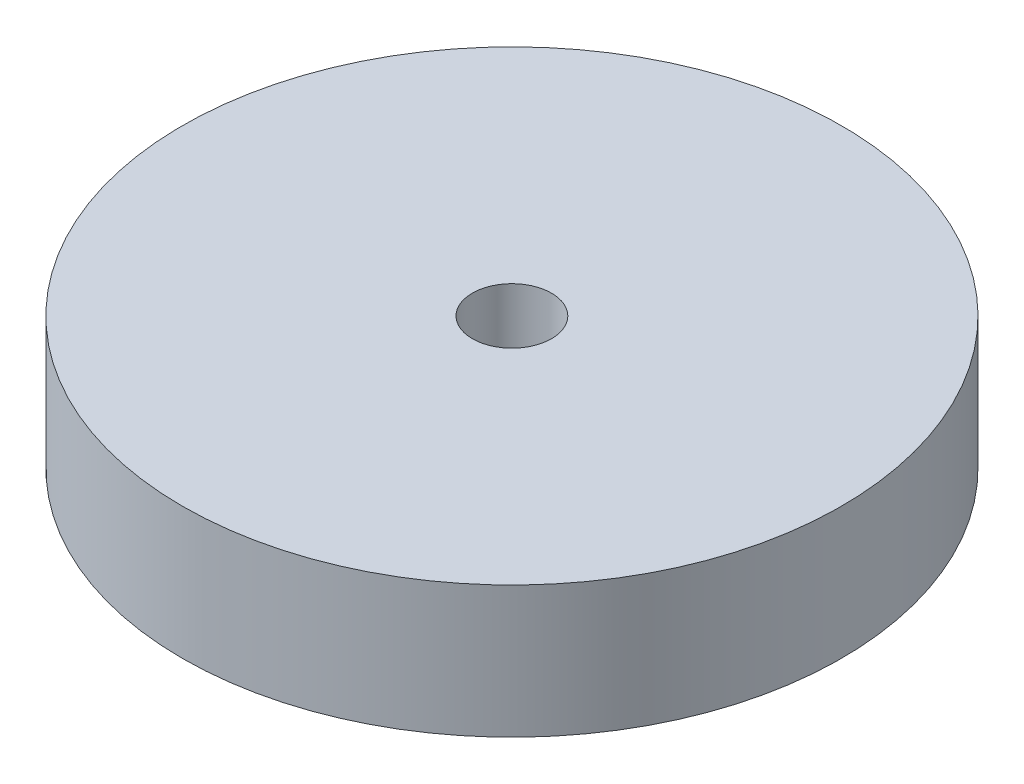
from build123d import *

# Parameters (mm, degrees)
SKETCH1_W = 220
SKETCH1_H = 100


with BuildPart() as part:
    # Sketch1 → Revolve1 (revolve)
    with BuildSketch(Plane(origin=(0, 0, 0), x_dir=(0, 0, -1), z_dir=(1, 0, 0))):
        with Locations((-140, 0)):
            Rectangle(SKETCH1_W, SKETCH1_H)
    revolve(axis=Axis((0, 265.422077922, 0), (0, -1, 0)))


solid = part.part
